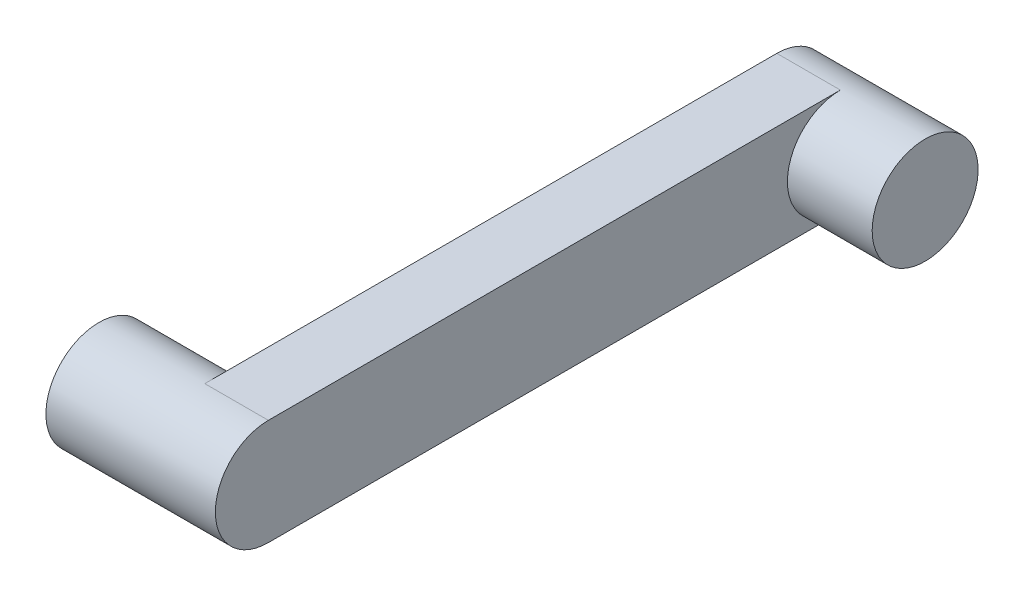
from build123d import *

# Parameters (mm, degrees)
SKETCH1_W           = 27
SKETCH1_H           = 5
BOSS_EXTRUDE1_DEPTH = 3
SKETCH2_R           = 2.5
BOSS_EXTRUDE2_DEPTH = 8
SKETCH3_R           = 2.5
BOSS_EXTRUDE3_DEPTH = 7


with BuildPart() as part:
    # Sketch1 → Boss-Extrude1 (new body)
    with BuildSketch(Plane(origin=(0, 0, 0), x_dir=(0, 0, -1), z_dir=(1, 0, 0))):
        Rectangle(SKETCH1_W, SKETCH1_H)
    extrude(amount=BOSS_EXTRUDE1_DEPTH)

    # Sketch2 → Boss-Extrude2 (add)
    with BuildSketch(Plane(origin=(3, 0, 0), x_dir=(0, 0, -1), z_dir=(1, 0, 0))):
        with Locations((-13.5, 0)):
            Circle(SKETCH2_R)
    extrude(amount=-BOSS_EXTRUDE2_DEPTH)

    # Sketch3 → Boss-Extrude3 (add)
    with BuildSketch(Plane.ZY):
        with Locations((-13.5, 0)):
            Circle(SKETCH3_R)
    extrude(amount=-BOSS_EXTRUDE3_DEPTH)


solid = part.part
